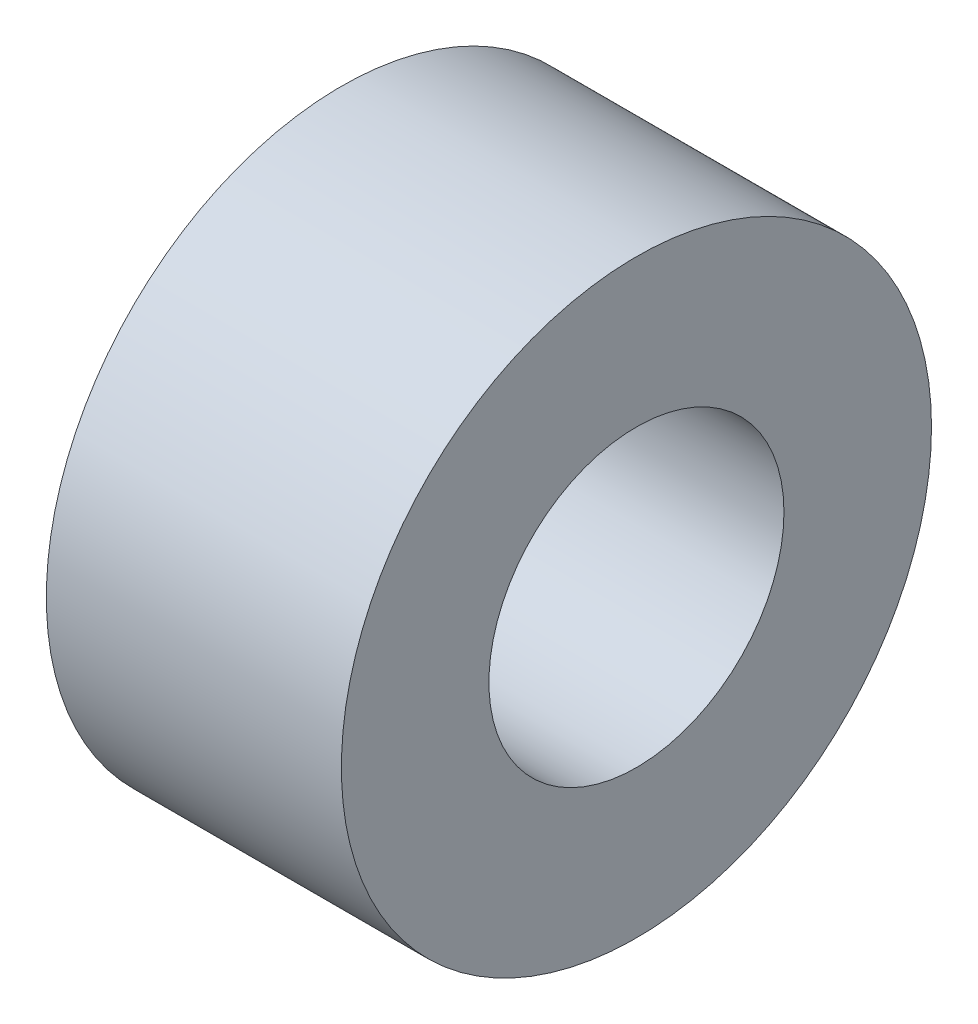
from build123d import *

# Parameters (mm, degrees)
SKETCH1_R           = 6.35
SKETCH1_R_2         = 3.175
BOSS_EXTRUDE1_DEPTH = 6.35


with BuildPart() as part:
    # Sketch1 → Boss-Extrude1 (new body)
    with BuildSketch(Plane(origin=(0, 0, 0), x_dir=(0, 0, -1), z_dir=(1, 0, 0))):
        Circle(SKETCH1_R)
        Circle(SKETCH1_R_2, mode=Mode.SUBTRACT)
    extrude(amount=BOSS_EXTRUDE1_DEPTH)


solid = part.part
